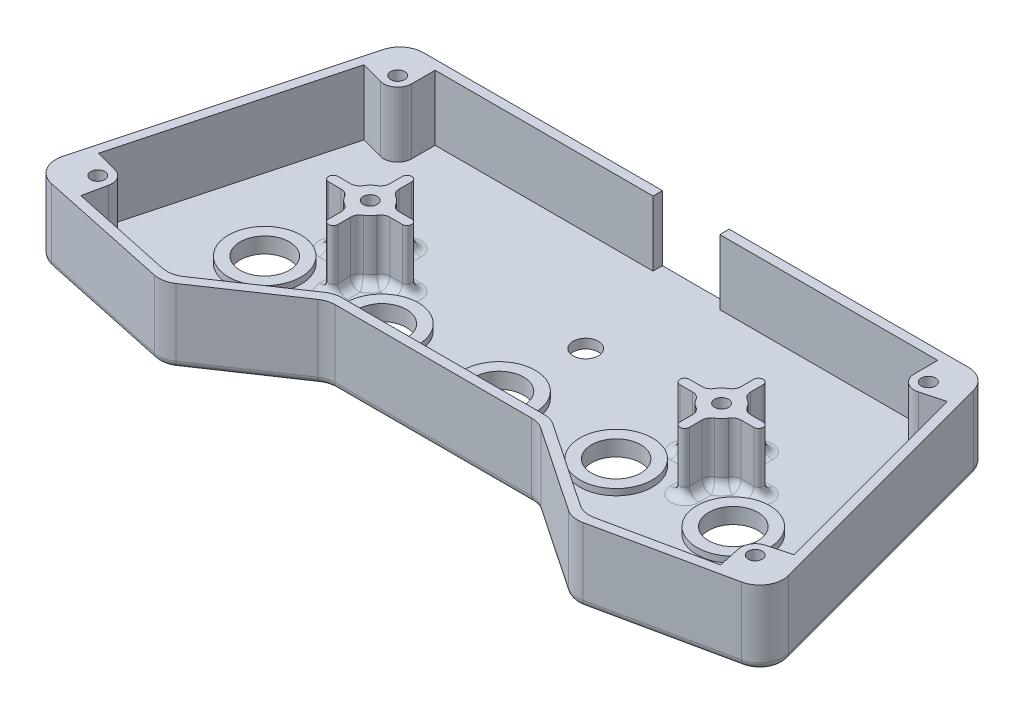
from build123d import *

# Parameters (mm, degrees)
SKETCH10_R            = 5.25
BOSS_EXTRUDE5_DEPTH   = 2
BOSS_EXTRUDE7_DEPTH   = 13.875
FILLET4_R             = 5
FILLET5_R             = 1.5
BOSS_EXTRUDE8_START   = 13.875
SKETCH12_R            = 1.5
BOSS_EXTRUDE8_DEPTH   = 13.875
SKETCH14_W            = 14.25
SKETCH14_H            = 13.875
CUT_EXTRUDE2_DEPTH    = 105.369420154
SKETCH15_R            = 2.7
CUT_EXTRUDE3_DEPTH    = 88.847278666
SKETCH16_R            = 7.75
SKETCH16_R_2          = 5.25
BOSS_EXTRUDE9_DEPTH   = 1.35
SKETCH17_R            = 1.5
PCB_MOUNT_POSTS_DEPTH = 12.875
FILLET6_R             = 2
FILLET6_OF_MIRROR1_R  = 2
RESET_DEPTH           = 0.5
SKETCH21_W            = 2
SKETCH21_H            = 8
CUT_EXTRUDE4_DEPTH    = 0.5
FILLET7_R             = 2


with BuildPart() as part:
    # Sketch10 → Boss-Extrude5 (new body)
    with BuildSketch(Plane(origin=(0, 0, 0), x_dir=(1, 0, 0), z_dir=(0, 1, 0))):
        Polygon((62, 32), (-62, 32), (-78.823237932, -30.785178709), (-43.64506924, -38.262529292), (-22.5, -24), (22.5, -24), (43.64506924, -38.262529292), (78.823237932, -30.785178709), align=None)
        with Locations(Location((50, -10, 0), (0, 0, 270))):
            Circle(SKETCH10_R, mode=Mode.SUBTRACT)
        with Locations(Location((0, -10, 0), (0, 0, 270))):
            Circle(SKETCH10_R, mode=Mode.SUBTRACT)
        with Locations(Location((25, -10, 0), (0, 0, 270))):
            Circle(SKETCH10_R, mode=Mode.SUBTRACT)
        with Locations(Location((-50, -10, 0), (0, 0, 270))):
            Circle(SKETCH10_R, mode=Mode.SUBTRACT)
        with Locations(Location((-25, -10, 0), (0, 0, 270))):
            Circle(SKETCH10_R, mode=Mode.SUBTRACT)
    extrude(amount=BOSS_EXTRUDE5_DEPTH)

    # Sketch11 → Boss-Extrude7 (add)
    with BuildSketch(Plane(origin=(0, 2, 0), x_dir=(1, 0, 0), z_dir=(0, 1, 0))):
        Polygon((-78.823237932, -30.785178709), (-62, 32), (62, 32), (78.823237932, -30.785178709), (43.64506924, -38.262529292), (22.5, -24), (-22.5, -24), (-43.64506924, -38.262529292), align=None)
        Polygon((-44.059643905, -36.129727537), (-76.345909548, -29.267069923), (-60.465346024, 30), (60.465346024, 30), (76.345909548, -29.267069923), (44.059643905, -36.129727537), (23.111461363, -22), (-23.111461363, -22), align=None, mode=Mode.SUBTRACT)
    extrude(amount=BOSS_EXTRUDE7_DEPTH)

    # Fillet4
    fillet4_edges = [part.edges().sort_by_distance(p)[0] for p in [
        (78.823237932, 7.9375, 30.785178709),
        (43.64506924, 7.9375, 38.262529292),
        (22.5, 7.9375, 24),
        (-22.5, 7.9375, 24),
        (-43.64506924, 7.9375, 38.262529292),
        (-78.823237932, 7.9375, 30.785178709),
        (-62, 7.9375, -32),
        (62, 7.9375, -32),
        (-23.111461363, 8.9375, 22),
        (23.111461363, 8.9375, 22),
        (44.059643905, 8.9375, 36.129727537),
        (76.345909548, 8.9375, 29.267069923),
        (60.465346024, 8.9375, -30),
        (-60.465346024, 8.9375, -30),
        (-76.345909548, 8.9375, 29.267069923),
        (-44.059643905, 8.9375, 36.129727537),
    ]]
    fillet(fillet4_edges, radius=FILLET4_R)

    # Fillet5
    fillet5_edges = [part.edges().sort_by_distance(p)[0] for p in [
        (22.433205116, 0, 24.21847622),
        (-22.433205116, 0, 24.21847622),
        (0, 0, -32),
        (70.226270147, 0, -1.299141854),
        (59.69526989, 0, 34.850953827),
        (32.826426247, 0, 30.965262452),
        (0, 0, 24),
        (-32.826426247, 0, 30.965262452),
        (-59.69526989, 0, 34.850953827),
        (-70.226270147, 0, -1.299141854),
        (-76.893117793, 0, 29.602399567),
        (-61.207172205, 0, -30.966766701),
        (-43.727460924, 0, 37.838660822),
        (43.727460924, 0, 37.838660822),
        (76.893117793, 0, 29.602399567),
        (61.207172205, 0, -30.966766701),
    ]]
    fillet(fillet5_edges, radius=FILLET5_R)

    # Sketch12 → Boss-Extrude8 (add)
    # profile 1 of 4: a face of its own
    with BuildSketch(Plane(origin=(0, 2, 0), x_dir=(1, 0, 0), z_dir=(0, 1, 0)).offset(BOSS_EXTRUDE8_START)):
        with BuildLine():
            Line((-62.234797351, 23.396317747), (-57.405168219, 22.102222521))
            ThreePointArc((-57.405168219, 22.102222521), (-54.802426797, 22.619939979), (-53.628711084, 25))
            Line((-53.628711084, 25), (-53.628711084, 30))
            Line((-53.628711084, 30), (-56.628711084, 30))
            ThreePointArc((-56.628711084, 30), (-59.672518229, 28.966766701), (-61.458340216, 26.294095226))
            Line((-61.458340216, 26.294095226), (-62.234797351, 23.396317747))
        make_face()
        with Locations(Location((-56.628711084, 25, 0), (0, 0, 90))):
            Circle(SKETCH12_R, mode=Mode.SUBTRACT)
    # profile 2 of 4: a face of its own
    with BuildSketch(Plane(origin=(0, 2, 0), x_dir=(1, 0, 0), z_dir=(0, 1, 0)).offset(BOSS_EXTRUDE8_START)):
        with BuildLine():
            Line((-74.982217719, -24.177702731), (-74.205760583, -21.279925252))
            Line((-74.205760583, -21.279925252), (-69.376131452, -22.574020478))
            ThreePointArc((-69.376131452, -22.574020478), (-67.594668094, -23.904302263), (-67.218145785, -26.095533029))
            Line((-67.218145785, -26.095533029), (-68.257704239, -30.986271033))
            Line((-68.257704239, -30.986271033), (-71.192147041, -30.362535961))
            ThreePointArc((-71.192147041, -30.362535961), (-74.415789409, -28.08429078), (-74.982217719, -24.177702731))
        make_face()
        with Locations(Location((-70.152588587, -25.471797957, 0), (0, 0, 90))):
            Circle(SKETCH12_R, mode=Mode.SUBTRACT)
    # profile 3 of 4: a face of its own
    with BuildSketch(Plane(origin=(0, 2, 0), x_dir=(1, 0, 0), z_dir=(0, 1, 0)).offset(BOSS_EXTRUDE8_START)):
        with BuildLine():
            Line((68.257704239, -30.986271033), (71.192147041, -30.362535961))
            ThreePointArc((71.192147041, -30.362535961), (74.415789409, -28.08429078), (74.982217719, -24.177702731))
            Line((74.982217719, -24.177702731), (74.205760583, -21.279925252))
            Line((74.205760583, -21.279925252), (69.376131452, -22.574020478))
            ThreePointArc((69.376131452, -22.574020478), (67.594668094, -23.904302263), (67.218145785, -26.095533029))
            Line((67.218145785, -26.095533029), (68.257704239, -30.986271033))
        make_face()
        with Locations(Location((70.152588587, -25.471797957, 0), (0, 0, 90))):
            Circle(SKETCH12_R, mode=Mode.SUBTRACT)
    # profile 4 of 4: a face of its own
    with BuildSketch(Plane(origin=(0, 2, 0), x_dir=(1, 0, 0), z_dir=(0, 1, 0)).offset(BOSS_EXTRUDE8_START)):
        with BuildLine():
            Line((61.458340216, 26.294095226), (62.234797351, 23.396317747))
            Line((62.234797351, 23.396317747), (57.405168219, 22.102222521))
            ThreePointArc((57.405168219, 22.102222521), (54.802426797, 22.619939979), (53.628711084, 25))
            Line((53.628711084, 25), (53.628711084, 30))
            Line((53.628711084, 30), (56.628711084, 30))
            ThreePointArc((56.628711084, 30), (59.672518229, 28.966766701), (61.458340216, 26.294095226))
        make_face()
        with Locations(Location((56.628711084, 25, 0), (0, 0, 90))):
            Circle(SKETCH12_R, mode=Mode.SUBTRACT)
    extrude(amount=-BOSS_EXTRUDE8_DEPTH)

    # Sketch14 → Cut-Extrude2 (cut, through all)
    with BuildSketch(Plane.XY.offset(-30)):
        with Locations((0, 8.9375)):
            Rectangle(SKETCH14_W, SKETCH14_H)
    extrude(amount=-CUT_EXTRUDE2_DEPTH, mode=Mode.SUBTRACT)

    # Sketch15 → Cut-Extrude3 (cut, through all)
    with BuildSketch(Plane.XZ):
        with Locations(Location((0, -8.5, 0), (0, 0, 270))):
            Circle(SKETCH15_R)
    extrude(amount=-CUT_EXTRUDE3_DEPTH, mode=Mode.SUBTRACT)

    # Sketch16 → Boss-Extrude9 (add)
    # profile 1 of 5: a face of its own
    with BuildSketch(Plane(origin=(0, 2, 0), x_dir=(1, 0, 0), z_dir=(0, 1, 0))):
        with Locations(Location((25, -10, 0), (0, 0, 90))):
            Circle(SKETCH16_R)
        with Locations(Location((25, -10, 0), (0, 0, 270))):
            Circle(SKETCH16_R_2, mode=Mode.SUBTRACT)
    # profile 2 of 5: a face of its own
    with BuildSketch(Plane(origin=(0, 2, 0), x_dir=(1, 0, 0), z_dir=(0, 1, 0))):
        with Locations(Location((0, -10, 0), (0, 0, 90))):
            Circle(SKETCH16_R)
        with Locations(Location((0, -10, 0), (0, 0, 270))):
            Circle(SKETCH16_R_2, mode=Mode.SUBTRACT)
    # profile 3 of 5: a face of its own
    with BuildSketch(Plane(origin=(0, 2, 0), x_dir=(1, 0, 0), z_dir=(0, 1, 0))):
        with Locations(Location((-50, -10, 0), (0, 0, 90))):
            Circle(SKETCH16_R)
        with Locations(Location((-50, -10, 0), (0, 0, 270))):
            Circle(SKETCH16_R_2, mode=Mode.SUBTRACT)
    # profile 4 of 5: a face of its own
    with BuildSketch(Plane(origin=(0, 2, 0), x_dir=(1, 0, 0), z_dir=(0, 1, 0))):
        with Locations(Location((-25, -10, 0), (0, 0, 90))):
            Circle(SKETCH16_R)
        with Locations(Location((-25, -10, 0), (0, 0, 270))):
            Circle(SKETCH16_R_2, mode=Mode.SUBTRACT)
    # profile 5 of 5: a face of its own
    with BuildSketch(Plane(origin=(0, 2, 0), x_dir=(1, 0, 0), z_dir=(0, 1, 0))):
        with Locations(Location((50, -10, 0), (0, 0, 90))):
            Circle(SKETCH16_R)
        with Locations(Location((50, -10, 0), (0, 0, 270))):
            Circle(SKETCH16_R_2, mode=Mode.SUBTRACT)
    boss_extrude9 = extrude(amount=BOSS_EXTRUDE9_DEPTH)

    # Sketch17 → PCB Mount Posts (add)
    with BuildSketch(Plane(origin=(0, 2, 0), x_dir=(1, 0, 0), z_dir=(0, 1, 0))):
        with BuildLine():
            Line((-38.5, 3.872983346), (-38.5, 7.872983346))
            ThreePointArc((-38.5, 7.872983346), (-37.5, 8.872983346), (-36.5, 7.872983346))
            Line((-36.5, 7.872983346), (-36.5, 3.872983346))
            ThreePointArc((-36.5, 3.872983346), (-34.671572875, 2.828427125), (-33.627016654, 1))
            Line((-33.627016654, 1), (-29.627016654, 1))
            ThreePointArc((-29.627016654, 1), (-28.627016654, 0), (-29.627016654, -1))
            Line((-29.627016654, -1), (-33.627016654, -1))
            ThreePointArc((-33.627016654, -1), (-34.671572875, -2.828427125), (-36.5, -3.872983346))
            Line((-36.5, -3.872983346), (-36.5, -7.872983346))
            ThreePointArc((-36.5, -7.872983346), (-37.5, -8.872983346), (-38.5, -7.872983346))
            Line((-38.5, -7.872983346), (-38.5, -3.872983346))
            ThreePointArc((-38.5, -3.872983346), (-40.328427125, -2.828427125), (-41.372983346, -1))
            Line((-41.372983346, -1), (-45.372983346, -1))
            ThreePointArc((-45.372983346, -1), (-46.372983346, 0), (-45.372983346, 1))
            Line((-45.372983346, 1), (-41.372983346, 1))
            ThreePointArc((-41.372983346, 1), (-40.328427125, 2.828427125), (-38.5, 3.872983346))
        make_face()
        with Locations(Location((-37.5, 0, 0), (0, 0, 90))):
            Circle(SKETCH17_R, mode=Mode.SUBTRACT)
    pcb_mount_posts = extrude(amount=PCB_MOUNT_POSTS_DEPTH)

    # Fillet6
    fillet6_edges = [part.edges().sort_by_distance(p)[0] for p in [
        (-38.5, 8.4375, -3.872983346),
        (-41.372983346, 8.4375, -1),
        (-41.372983346, 8.4375, 1),
        (-38.5, 8.4375, 3.872983346),
        (-36.5, 8.4375, 3.872983346),
        (-33.627016654, 8.4375, 1),
        (-33.627016654, 8.4375, -1),
        (-36.5, 8.4375, -3.872983346),
    ]]
    fillet(fillet6_edges, radius=FILLET6_R)

    # Mirror1: Boss-Extrude9, PCB Mount Posts across plane
    add(boss_extrude9.mirror(Plane(origin=(0, 0, 0), x_dir=(0, 0, 1), z_dir=(1, 0, 0))))
    add(pcb_mount_posts.mirror(Plane(origin=(0, 0, 0), x_dir=(0, 0, 1), z_dir=(1, 0, 0))))

    # Fillet6 of Mirror1
    fillet6_of_mirror1_edges = [part.edges().sort_by_distance(p)[0] for p in [
        (38.5, 8.4375, -3.872983346),
        (41.372983346, 8.4375, -1),
        (41.372983346, 8.4375, 1),
        (38.5, 8.4375, 3.872983346),
        (36.5, 8.4375, 3.872983346),
        (33.627016654, 8.4375, 1),
        (33.627016654, 8.4375, -1),
        (36.5, 8.4375, -3.872983346),
    ]]
    fillet(fillet6_of_mirror1_edges, radius=FILLET6_OF_MIRROR1_R)

    # Sketch20 → Reset (cut)
    # profile 1 of 5: a face of its own
    with BuildSketch(Plane.XZ):
        with BuildLine():
            Line((11.025641026, 2), (11.025641026, -3))
            Line((11.025641026, -3), (8.927283654, -3))
            add(Edge.make_bspline(
                [(8.927283654, -3), (8.863512543, -2.999606756), (8.740613942, -2.998848903), (8.562877876, -2.993328614), (8.398967863, -2.981746945), (8.248145649, -2.968675286), (8.11084701, -2.949454246), (7.986741931, -2.926885756), (7.876230682, -2.900213258), (7.778094539, -2.86881071), (7.68896123, -2.83202205), (7.605638167, -2.789125234), (7.527337897, -2.738483869), (7.453033924, -2.682224883), (7.382437811, -2.620197694), (7.317477911, -2.550778089), (7.257024371, -2.474995072), (7.201125445, -2.393480444), (7.151882019, -2.306593788), (7.106886449, -2.217125584), (7.070258359, -2.124123731), (7.040003889, -2.028026344), (7.015836152, -1.92904206), (6.999061701, -1.826919227), (6.988589591, -1.721842689), (6.987654745, -1.650866534), (6.987179487, -1.614783654)],
                knots=[0, 0, 0, 0, 1.675792322, 3.229558513, 4.671612708, 5.993327294, 7.206773438, 8.313218507, 9.306927966, 10.191988363, 11.018030861, 11.838135071, 12.650980327, 13.465150207, 14.285535933, 15.117196726, 15.959844754, 16.83101188, 17.711363548, 18.582398133, 19.460517458, 20.334551361, 21.228266118, 22.135486512, 23.052118027, 24, 24, 24, 24], degree=3))
            add(Edge.make_bspline(
                [(6.987179487, -1.614783654), (6.988050087, -1.569325879), (6.989751479, -1.480488858), (7.005758409, -1.350339573), (7.028766193, -1.225677662), (7.064332772, -1.107575235), (7.108555683, -0.995143884), (7.162585643, -0.889173559), (7.226349993, -0.788670545), (7.300176873, -0.695055829), (7.383770047, -0.60814086), (7.477601136, -0.529824729), (7.581050065, -0.459288915), (7.694963453, -0.398643153), (7.817377656, -0.345197285), (7.949905034, -0.301285835), (8.09186179, -0.265192358), (8.190634164, -0.248252935), (8.241185897, -0.239583333)],
                knots=[0, 0, 0, 0, 1.059179627, 2.069928931, 3.052909591, 4.01082991, 4.940120368, 5.865982481, 6.779263376, 7.710344595, 8.640547144, 9.585223395, 10.554458868, 11.553878165, 12.589111246, 13.664634927, 14.804759383, 16, 16, 16, 16], degree=3))
            add(Edge.make_bspline(
                [(8.241185897, -0.239583333), (8.192243228, -0.207276298), (8.096674398, -0.144191354), (7.965068549, -0.038864489), (7.845901767, 0.069816887), (7.754602961, 0.166482006), (7.686941028, 0.253007065), (7.630212166, 0.327107601), (7.5703309, 0.41349715), (7.507024811, 0.511744063), (7.437142709, 0.619902922), (7.36459763, 0.740144484), (7.287356731, 0.871299581), (7.235440246, 0.962928458), (7.208533654, 1.010416667)],
                knots=[0, 0, 0, 0, 1.285418496, 2.509996711, 3.691467871, 4.820794806, 5.41993176, 6.099351199, 6.867072027, 7.724003792, 8.66229716, 9.690641339, 10.803135971, 12, 12, 12, 12], degree=3))
            Line((7.208533654, 1.010416667), (6.602564103, 2))
            Line((6.602564103, 2), (7.726362179, 2))
            Line((7.726362179, 2), (8.4375, 0.865184295))
            add(Edge.make_bspline(
                [(8.4375, 0.865184295), (8.470139934, 0.819720585), (8.532456279, 0.732921017), (8.622722953, 0.60981263), (8.704212963, 0.499467609), (8.77928194, 0.403634592), (8.843250117, 0.318719951), (8.901913241, 0.249262461), (8.950543058, 0.191131326), (9.005772249, 0.133686189), (9.069476637, 0.074211291), (9.149806772, 0.018802435), (9.2297372, -0.029064172), (9.317657939, -0.063474595), (9.419040173, -0.087638296), (9.540863801, -0.10327), (9.686620075, -0.114667605), (9.79197229, -0.115133496), (9.848758013, -0.115384615)],
                knots=[0, 0, 0, 0, 1.465455604, 2.797856031, 3.997287567, 5.056931524, 5.985455892, 6.78017684, 7.437295394, 7.969061152, 8.866444478, 9.712992237, 10.519739188, 11.300587223, 12.174148835, 13.242341053, 14.513598822, 16, 16, 16, 16], degree=3))
            Line((9.848758013, -0.115384615), (10.064102564, -0.115384615))
            Line((10.064102564, -0.115384615), (10.064102564, 2))
            Line((10.064102564, 2), (11.025641026, 2))
        make_face()
        with BuildLine():
            Line((10.064102564, -0.948717949), (9.289863782, -0.948717949))
            add(Edge.make_bspline(
                [(9.289863782, -0.948717949), (9.230098536, -0.948844786), (9.116235643, -0.949086433), (8.954321494, -0.952636771), (8.810007094, -0.955579097), (8.683507337, -0.963253975), (8.574558112, -0.970574327), (8.483297446, -0.980345223), (8.409605055, -0.991814459), (8.33600408, -1.00965948), (8.260585736, -1.040726711), (8.180312407, -1.085065136), (8.111134251, -1.142429562), (8.052836991, -1.209710554), (8.00601765, -1.286776549), (7.972816106, -1.373575108), (7.952661909, -1.46930203), (7.950059259, -1.536224009), (7.948717949, -1.570713141)],
                knots=[0, 0, 0, 0, 1.698225007, 3.235405601, 4.602081082, 5.799304338, 6.836184345, 7.704711386, 8.406567597, 8.954198466, 9.852676441, 10.715224147, 11.550954709, 12.391678278, 13.234486884, 14.099535337, 15.020570272, 16, 16, 16, 16], degree=3))
            add(Edge.make_bspline(
                [(7.948717949, -1.570713141), (7.950377173, -1.609270794), (7.95357838, -1.683661568), (7.980123116, -1.789348623), (8.023376935, -1.883897656), (8.08579062, -1.965092052), (8.164437004, -2.033027149), (8.257645622, -2.087021902), (8.364934266, -2.127863909), (8.44219536, -2.142823252), (8.482572115, -2.150641026)],
                knots=[0, 0, 0, 0, 1.062151159, 2.049249396, 2.984342979, 3.910691218, 4.850532992, 5.832809367, 6.867423153, 8, 8, 8, 8], degree=3))
            add(Edge.make_bspline(
                [(8.482572115, -2.150641026), (8.495916592, -2.152107297), (8.527545803, -2.155582668), (8.583399241, -2.157814746), (8.654815027, -2.161245692), (8.742657577, -2.162647844), (8.846142112, -2.165105692), (8.965680132, -2.165557015), (9.100891855, -2.166998959), (9.196380298, -2.166781485), (9.246794872, -2.166666667)],
                knots=[0, 0, 0, 0, 0.42127143, 0.998501726, 1.753681744, 2.66564073, 3.755712164, 5.002818897, 6.417592707, 8, 8, 8, 8], degree=3))
            Line((9.246794872, -2.166666667), (10.064102564, -2.166666667))
            Line((10.064102564, -2.166666667), (10.064102564, -0.948717949))
        make_face(mode=Mode.SUBTRACT)
    # profile 2 of 5: a face of its own
    with BuildSketch(Plane.XZ):
        Polygon((6.025641026, 2), (6.025641026, -3), (2.307692308, -3), (2.307692308, -2.166666667), (5.064102564, -2.166666667), (5.064102564, -1.076923077), (2.5, -1.076923077), (2.5, -0.243589744), (5.064102564, -0.243589744), (5.064102564, 1.166666667), (2.243589744, 1.166666667), (2.243589744, 2), align=None)
    # profile 3 of 5: a face of its own
    with BuildSketch(Plane.XZ):
        with BuildLine():
            Line((1.666666667, 0.333333333), (0.705128205, 0.269230769))
            add(Edge.make_bspline(
                [(0.705128205, 0.269230769), (0.697464847, 0.309456303), (0.68257926, 0.387591844), (0.649561259, 0.498976087), (0.613024996, 0.602705441), (0.569979465, 0.698326128), (0.520588225, 0.785485351), (0.467009623, 0.865722936), (0.405171327, 0.935733541), (0.338532842, 0.998563322), (0.2662848, 1.054031331), (0.187402502, 1.101171182), (0.102853073, 1.141297695), (0.0124506, 1.174606495), (-0.084611963, 1.199428822), (-0.187451473, 1.217100188), (-0.296226116, 1.228413333), (-0.370564494, 1.229971077), (-0.408653846, 1.230769231)],
                knots=[0, 0, 0, 0, 1.20488818, 2.340418651, 3.416218944, 4.44124326, 5.42273598, 6.3633601, 7.276039664, 8.166155299, 9.056759279, 9.95190829, 10.866438651, 11.808704887, 12.783827256, 13.811628592, 14.87872657, 16, 16, 16, 16], degree=3))
            add(Edge.make_bspline(
                [(-0.408653846, 1.230769231), (-0.448744142, 1.230328286), (-0.526721832, 1.229470625), (-0.639739857, 1.218964801), (-0.745345047, 1.203676788), (-0.843024283, 1.180289368), (-0.933264772, 1.151560383), (-1.016155478, 1.116724995), (-1.091065325, 1.074283163), (-1.157786029, 1.025288641), (-1.216405533, 0.972197687), (-1.26841405, 0.91763242), (-1.312777713, 0.86099994), (-1.348034375, 0.800766591), (-1.376509966, 0.739258544), (-1.395343112, 0.674718751), (-1.408062627, 0.608609136), (-1.409521425, 0.563428436), (-1.41025641, 0.540665064)],
                knots=[0, 0, 0, 0, 1.418030258, 2.758141892, 4.012849053, 5.190504034, 6.307525772, 7.360759663, 8.365925826, 9.346494891, 10.283396317, 11.160841652, 12.011476082, 12.821866951, 13.625513811, 14.402856512, 15.195311921, 16, 16, 16, 16], degree=3))
            add(Edge.make_bspline(
                [(-1.41025641, 0.540665064), (-1.40878077, 0.512198468), (-1.405899305, 0.456612062), (-1.387107312, 0.376073152), (-1.352748765, 0.303153669), (-1.307193455, 0.234478754), (-1.242269477, 0.173583774), (-1.159662323, 0.117480932), (-1.057768794, 0.065763024), (-0.981889886, 0.037093258), (-0.94150641, 0.021834936)],
                knots=[0, 0, 0, 0, 0.905846913, 1.768837225, 2.610049893, 3.458473086, 4.374844099, 5.420736139, 6.627291253, 8, 8, 8, 8], degree=3))
            add(Edge.make_bspline(
                [(-0.94150641, 0.021834936), (-0.924185474, 0.016029517), (-0.88542403, 0.003037934), (-0.819294232, -0.015514092), (-0.739367218, -0.038908077), (-0.644900107, -0.064737197), (-0.536085574, -0.092273126), (-0.413957338, -0.125222386), (-0.276660839, -0.158329884), (-0.180595526, -0.182719978), (-0.130208333, -0.195512821)],
                knots=[0, 0, 0, 0, 0.521824192, 1.167757792, 1.961731518, 2.901193269, 3.965386864, 5.168422915, 6.514810244, 8, 8, 8, 8], degree=3))
            add(Edge.make_bspline(
                [(-0.130208333, -0.195512821), (-0.064596001, -0.211908749), (0.061992264, -0.243542012), (0.242620816, -0.299600898), (0.408562413, -0.356009923), (0.559809087, -0.414702209), (0.695253649, -0.47775992), (0.81539444, -0.543609553), (0.921271662, -0.611419586), (0.98299957, -0.662018021), (1.012620192, -0.686298077)],
                knots=[0, 0, 0, 0, 1.293827876, 2.496229314, 3.617486305, 4.647214227, 5.598941135, 6.473853732, 7.267666729, 8, 8, 8, 8], degree=3))
            add(Edge.make_bspline(
                [(1.012620192, -0.686298077), (1.049350462, -0.720688471), (1.121363553, -0.788114018), (1.21615761, -0.898907132), (1.29581043, -1.015942331), (1.361373421, -1.138355738), (1.411855684, -1.266852082), (1.447636863, -1.400571262), (1.470795742, -1.539862271), (1.473158946, -1.634722749), (1.474358974, -1.682892628)],
                knots=[0, 0, 0, 0, 1.064429417, 2.086912298, 3.078678339, 4.055528992, 5.020032834, 5.993708893, 6.981211098, 8, 8, 8, 8], degree=3))
            add(Edge.make_bspline(
                [(1.474358974, -1.682892628), (1.471954777, -1.744874954), (1.467160191, -1.868483565), (1.425300779, -2.050093903), (1.35807004, -2.225376886), (1.282124828, -2.365071392), (1.207960421, -2.470503963), (1.14684799, -2.54658458), (1.078393304, -2.616174319), (1.005087669, -2.681816873), (0.925691576, -2.742105914), (0.840109821, -2.796686781), (0.749951015, -2.84881015), (0.618389145, -2.908622161), (0.440734795, -2.972509861), (0.209559556, -3.026083371), (-0.042169317, -3.05810222), (-0.216915624, -3.062054155), (-0.307491987, -3.064102564)],
                knots=[0, 0, 0, 0, 1.173947207, 2.341150979, 3.513236498, 4.725701586, 5.343846563, 5.955802443, 6.573558365, 7.192286467, 7.820239033, 8.461107874, 9.115924059, 9.792795698, 11.198380683, 12.687719459, 14.283143537, 16, 16, 16, 16], degree=3))
            add(Edge.make_bspline(
                [(-0.307491987, -3.064102564), (-0.381657158, -3.063114576), (-0.525906829, -3.061192959), (-0.734996694, -3.041635469), (-0.930038397, -3.011504882), (-1.110712626, -2.967357617), (-1.277359567, -2.910403066), (-1.430303981, -2.841539933), (-1.569143977, -2.760144), (-1.69240384, -2.665391988), (-1.802220033, -2.560946539), (-1.898016217, -2.446858578), (-1.980159878, -2.324572738), (-2.049180837, -2.194177396), (-2.103382829, -2.055002392), (-2.143192049, -1.907221318), (-2.169522213, -1.751182034), (-2.176121948, -1.644262357), (-2.179487179, -1.58974359)],
                knots=[0, 0, 0, 0, 1.325136797, 2.577362738, 3.74962816, 4.849499017, 5.896771726, 6.892816139, 7.842473141, 8.766187929, 9.665133525, 10.546015357, 11.42313021, 12.293255665, 13.177485873, 14.086514152, 15.024305989, 16, 16, 16, 16], degree=3))
            Line((-2.179487179, -1.58974359), (-1.217948718, -1.525641026))
            add(Edge.make_bspline(
                [(-1.217948718, -1.525641026), (-1.212405829, -1.555794574), (-1.201603314, -1.614560703), (-1.178043825, -1.69868789), (-1.151723437, -1.776634742), (-1.119990127, -1.847892445), (-1.084847595, -1.912977053), (-1.042912025, -1.970429797), (-0.997689433, -2.022110267), (-0.947502102, -2.068025865), (-0.889972571, -2.10579807), (-0.828147336, -2.140410433), (-0.759021803, -2.168258347), (-0.683604424, -2.191277808), (-0.601482299, -2.208921556), (-0.513197439, -2.222182556), (-0.418429815, -2.228617555), (-0.353238925, -2.230035586), (-0.319511218, -2.230769231)],
                knots=[0, 0, 0, 0, 1.150553354, 2.242308823, 3.277014372, 4.23670984, 5.168153214, 6.048332296, 6.900942248, 7.744193269, 8.592553541, 9.478959334, 10.400821359, 11.384212586, 12.436611839, 13.55172301, 14.733338838, 16, 16, 16, 16], degree=3))
            add(Edge.make_bspline(
                [(-0.319511218, -2.230769231), (-0.284443081, -2.230122508), (-0.216216455, -2.228864279), (-0.116792075, -2.221142715), (-0.023524548, -2.206889451), (0.064044191, -2.188335238), (0.14579717, -2.163093513), (0.221561866, -2.132315365), (0.291684907, -2.096080009), (0.33444288, -2.067571283), (0.35556891, -2.053485577)],
                knots=[0, 0, 0, 0, 1.186678824, 2.308736671, 3.37120409, 4.377216403, 5.334874112, 6.262130804, 7.141346615, 8, 8, 8, 8], degree=3))
            add(Edge.make_bspline(
                [(0.35556891, -2.053485577), (0.379745879, -2.034244102), (0.426569162, -1.996979338), (0.476960923, -1.922984188), (0.507296879, -1.839408883), (0.510948156, -1.780307107), (0.512820513, -1.75)],
                knots=[0, 0, 0, 0, 1.037857257, 2.010007357, 2.979541333, 4, 4, 4, 4], degree=3))
            add(Edge.make_bspline(
                [(0.512820513, -1.75), (0.511289266, -1.721675996), (0.508272954, -1.665882217), (0.477849559, -1.586625945), (0.431062524, -1.513189308), (0.387347713, -1.473297565), (0.364583333, -1.452524038)],
                knots=[0, 0, 0, 0, 0.98538058, 1.941042925, 2.927803204, 4, 4, 4, 4], degree=3))
            add(Edge.make_bspline(
                [(0.364583333, -1.452524038), (0.34655278, -1.438661358), (0.30645293, -1.407830834), (0.232374747, -1.36951085), (0.142676524, -1.329366046), (0.036182498, -1.288708213), (-0.086721894, -1.24687092), (-0.226674495, -1.204685982), (-0.383598073, -1.163356075), (-0.552749223, -1.121453525), (-0.724724768, -1.080809333), (-0.888796706, -1.036207297), (-1.041369622, -0.99276139), (-1.181723468, -0.947213426), (-1.310584703, -0.902874751), (-1.427326922, -0.857335352), (-1.532750959, -0.812984697), (-1.655690041, -0.752001527), (-1.795010427, -0.66938394), (-1.941114565, -0.549346406), (-2.069847141, -0.414400402), (-2.16044744, -0.287887387), (-2.221984133, -0.178572101), (-2.262079019, -0.09109996), (-2.29604857, 0.001352728), (-2.324335035, 0.098324891), (-2.344602587, 0.200004566), (-2.361427369, 0.305812398), (-2.370013025, 0.416656063), (-2.37119453, 0.492242421), (-2.371794872, 0.530649038)],
                knots=[0, 0, 0, 0, 0.516255311, 1.148148894, 1.888861859, 2.751620851, 3.738268431, 4.840557414, 6.07428004, 7.42751106, 8.802854092, 10.091833706, 11.293062756, 12.409377658, 13.44651028, 14.39102378, 15.258213098, 16.045831186, 17.510454751, 18.929597364, 20.331088364, 21.740370042, 22.45410143, 23.180993031, 23.925547029, 24.691954406, 25.475059937, 26.281333581, 27.126718562, 28, 28, 28, 28], degree=3))
            add(Edge.make_bspline(
                [(-2.371794872, 0.530649038), (-2.370969956, 0.566068704), (-2.369331754, 0.636408729), (-2.357877417, 0.740809533), (-2.340180276, 0.843362481), (-2.313920716, 0.944167062), (-2.279413024, 1.042842848), (-2.239758546, 1.140706762), (-2.19109172, 1.236254026), (-2.135326976, 1.329439521), (-2.073850241, 1.419985861), (-2.004263245, 1.503611657), (-1.930096286, 1.582774434), (-1.848696343, 1.654382442), (-1.761840222, 1.721179094), (-1.669059123, 1.782318575), (-1.569261327, 1.836243513), (-1.463633578, 1.884748465), (-1.351183886, 1.926199021), (-1.232722039, 1.963804323), (-1.107092517, 1.994309087), (-0.975158352, 2.020513006), (-0.836404333, 2.040425418), (-0.691013149, 2.054332917), (-0.538949128, 2.062174928), (-0.435371977, 2.063452035), (-0.382612179, 2.064102564)],
                knots=[0, 0, 0, 0, 0.900628843, 1.788561637, 2.667969556, 3.545243585, 4.433987869, 5.324838569, 6.228543762, 7.157540832, 8.0854509, 9.008414572, 9.921286615, 10.841434221, 11.761855989, 12.706168708, 13.66363463, 14.643868656, 15.659463426, 16.709434498, 17.802891778, 18.94516574, 20.129089662, 21.365930774, 22.658266237, 24, 24, 24, 24], degree=3))
            add(Edge.make_bspline(
                [(-0.382612179, 2.064102564), (-0.306435968, 2.062856427), (-0.158119078, 2.060430168), (0.057372145, 2.038788633), (0.259439358, 2.005497727), (0.448086133, 1.957723023), (0.62264967, 1.894458934), (0.783835688, 1.818309281), (0.931867911, 1.72882813), (1.06539809, 1.623927054), (1.186010801, 1.506179554), (1.294209392, 1.376186276), (1.388056645, 1.232845744), (1.471277925, 1.078196802), (1.538400773, 0.909274821), (1.596101176, 0.729207441), (1.638968102, 0.535627072), (1.65727413, 0.401930802), (1.666666667, 0.333333333)],
                knots=[0, 0, 0, 0, 1.218103624, 2.371676645, 3.460273052, 4.491233435, 5.479430108, 6.425326546, 7.338411542, 8.239993733, 9.134972932, 10.029968061, 10.939344716, 11.871025474, 12.833908042, 13.842158617, 14.892845271, 16, 16, 16, 16], degree=3))
        make_face()
    # profile 4 of 5: a face of its own
    with BuildSketch(Plane.XZ):
        Polygon((-3.205128205, 2), (-3.205128205, -3), (-6.923076923, -3), (-6.923076923, -2.166666667), (-4.166666667, -2.166666667), (-4.166666667, -1.076923077), (-6.730769231, -1.076923077), (-6.730769231, -0.243589744), (-4.166666667, -0.243589744), (-4.166666667, 1.166666667), (-6.987179487, 1.166666667), (-6.987179487, 2), align=None)
    # profile 5 of 5: a face of its own
    with BuildSketch(Plane.XZ):
        Polygon((-8.974358974, 2), (-8.974358974, -2.166666667), (-7.5, -2.166666667), (-7.5, -3), (-11.41025641, -3), (-11.41025641, -2.166666667), (-9.935897436, -2.166666667), (-9.935897436, 2), align=None)
    extrude(amount=-RESET_DEPTH, mode=Mode.SUBTRACT)

    # Sketch21 → Cut-Extrude4 (cut)
    # profile 1 of 3: a face of its own
    with BuildSketch(Plane.XZ):
        Polygon((27.309401077, -5), (27.309401077, 3), (20.381197846, -1), align=None)
        Polygon((22.881197846, -1), (26.059401077, -2.834936491), (26.059401077, 0.834936491), align=None, mode=Mode.SUBTRACT)
    # profile 2 of 3: a face of its own
    with BuildSketch(Plane.XZ):
        with Locations((-22.5, -1)):
            Rectangle(SKETCH21_W, SKETCH21_H)
    # profile 3 of 3: a face of its own
    with BuildSketch(Plane.XZ):
        with Locations((-27.5, -1)):
            Rectangle(SKETCH21_W, SKETCH21_H)
    extrude(amount=-CUT_EXTRUDE4_DEPTH, mode=Mode.SUBTRACT)

    # Fillet7
    fillet7_edges = [part.edges().sort_by_distance(p)[0] for p in [
        (-46.372983346, 2, 0),
        (-44.034567884, 2, 1),
        (-37.5, 2, 8.872983346),
        (-36.5, 2, 6.534567884),
        (-28.627016654, 2, 0),
        (-30.965432116, 2, -1),
        (-37.5, 2, -8.872983346),
        (-38.5, 2, -6.534567884),
        (-30.965432116, 2, 1),
        (-40.328427125, 2, -2.828427125),
        (-36.5, 2, -6.534567884),
        (-34.671572875, 2, -2.828427125),
        (-34.671572875, 2, 2.828427125),
        (-38.5, 2, 6.534567884),
        (-40.328427125, 2, 2.828427125),
        (-44.034567884, 2, -1),
        (-33.303847577, 2, -1.267949192),
        (-36.232050808, 2, -4.196152423),
        (-38.767949192, 2, -4.196152423),
        (-41.696152423, 2, -1.267949192),
        (-41.696152423, 2, 1.267949192),
        (-38.767949192, 2, 4.196152423),
        (-36.232050808, 2, 4.196152423),
        (-33.303847577, 2, 1.267949192),
        (46.372983346, 2, 0),
        (44.034567884, 2, 1),
        (37.5, 2, 8.872983346),
        (36.5, 2, 6.534567884),
        (28.627016654, 2, 0),
        (30.965432116, 2, -1),
        (37.5, 2, -8.872983346),
        (38.5, 2, -6.534567884),
        (34.671572875, 2, 2.828427125),
        (40.328427125, 2, -2.828427125),
        (44.034567884, 2, -1),
        (40.328427125, 2, 2.828427125),
        (38.5, 2, 6.534567884),
        (30.965432116, 2, 1),
        (34.671572875, 2, -2.828427125),
        (36.5, 2, -6.534567884),
        (33.303847577, 2, -1.267949192),
        (36.232050808, 2, -4.196152423),
        (38.767949192, 2, -4.196152423),
        (41.696152423, 2, -1.267949192),
        (41.696152423, 2, 1.267949192),
        (38.767949192, 2, 4.196152423),
        (36.232050808, 2, 4.196152423),
        (33.303847577, 2, 1.267949192),
    ]]
    fillet(fillet7_edges, radius=FILLET7_R)


solid = part.part
